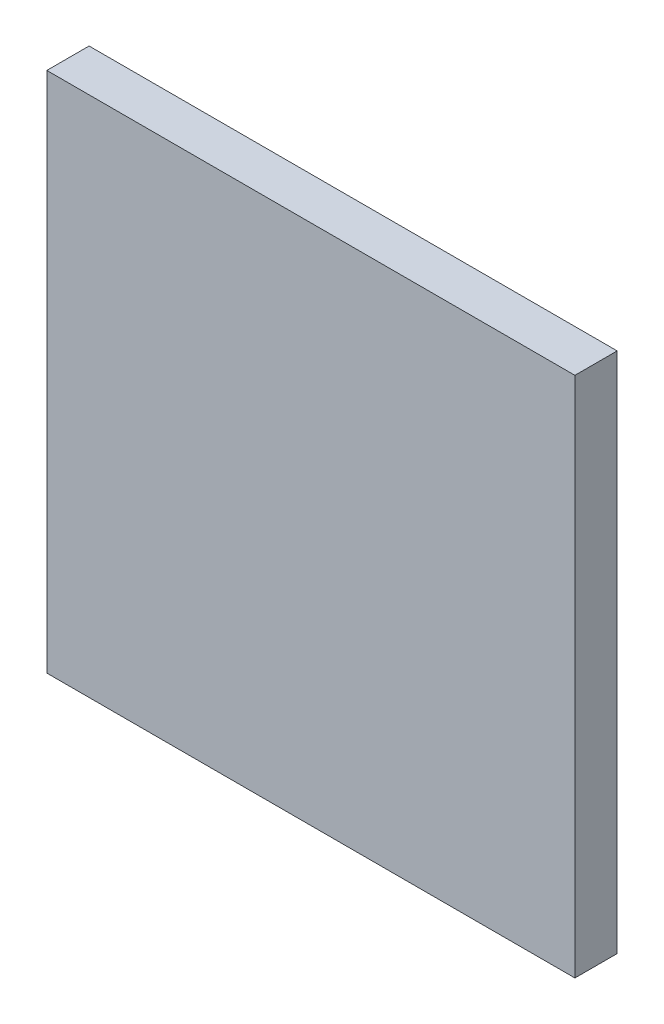
from build123d import *

# Parameters (mm, degrees)
SKETCH1_W               = 12.49
SKETCH1_H               = 12.344703
COMPONENT_OUTLINE_DEPTH = 1


with BuildPart() as part:
    # Sketch1 → Component_Outline (new body)
    with BuildSketch(Plane.XY):
        with Locations((0, 0.4273515)):
            Rectangle(SKETCH1_W, SKETCH1_H)
    extrude(amount=COMPONENT_OUTLINE_DEPTH)


solid = part.part
